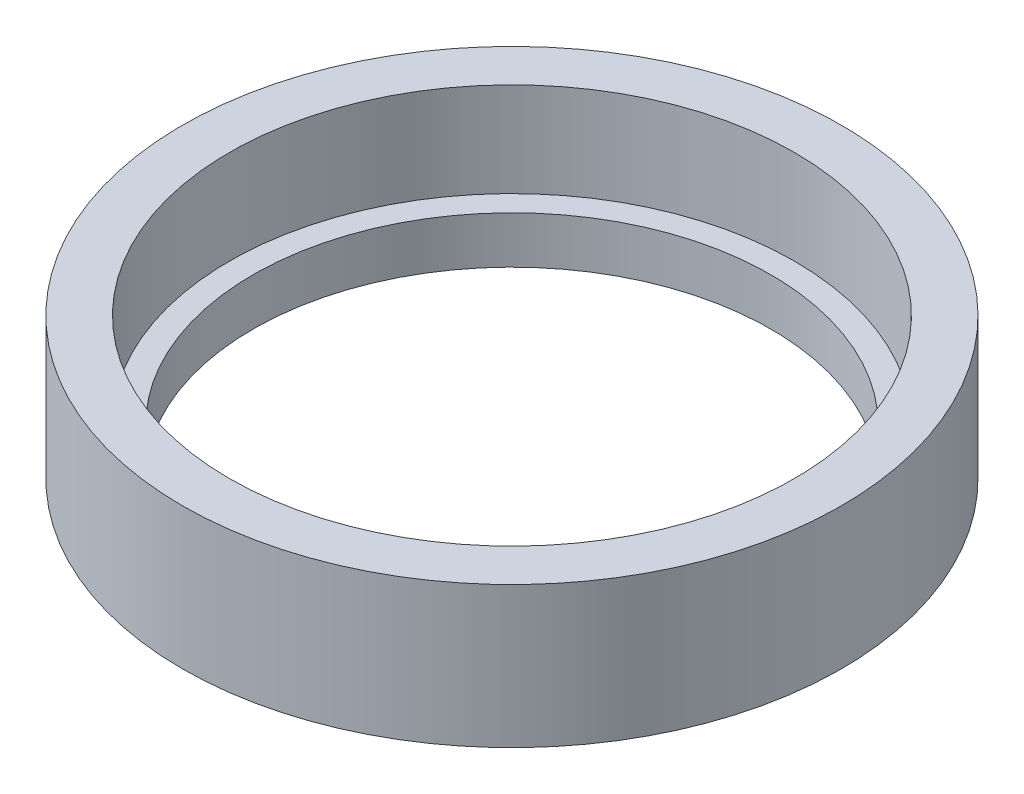
from build123d import *

# Parameters (mm, degrees)
SKETCH1_R      = 35
SKETCH1_R_2    = 27.5
EXTRUDE1_DEPTH = 15
SKETCH3_R      = 30
EXTRUDE3_DEPTH = 10


with BuildPart() as part:
    # Sketch1 → Extrude1 (new body)
    with BuildSketch(Plane(origin=(0, 0, 0), x_dir=(1, 0, 0), z_dir=(0, 1, 0))):
        with Locations(Location((0, 0, 0), (0, 0, 270))):
            Circle(SKETCH1_R)
        with Locations(Location((0, 0, 0), (0, 0, 270))):
            Circle(SKETCH1_R_2, mode=Mode.SUBTRACT)
    extrude(amount=EXTRUDE1_DEPTH)

    # Sketch3 → Extrude3 (cut)
    with BuildSketch(Plane(origin=(0, 15, 0), x_dir=(1, 0, 0), z_dir=(0, 1, 0))):
        with Locations(Location((0, 0, 0), (0, 0, 270))):
            Circle(SKETCH3_R)
    extrude(amount=-EXTRUDE3_DEPTH, mode=Mode.SUBTRACT)


solid = part.part
